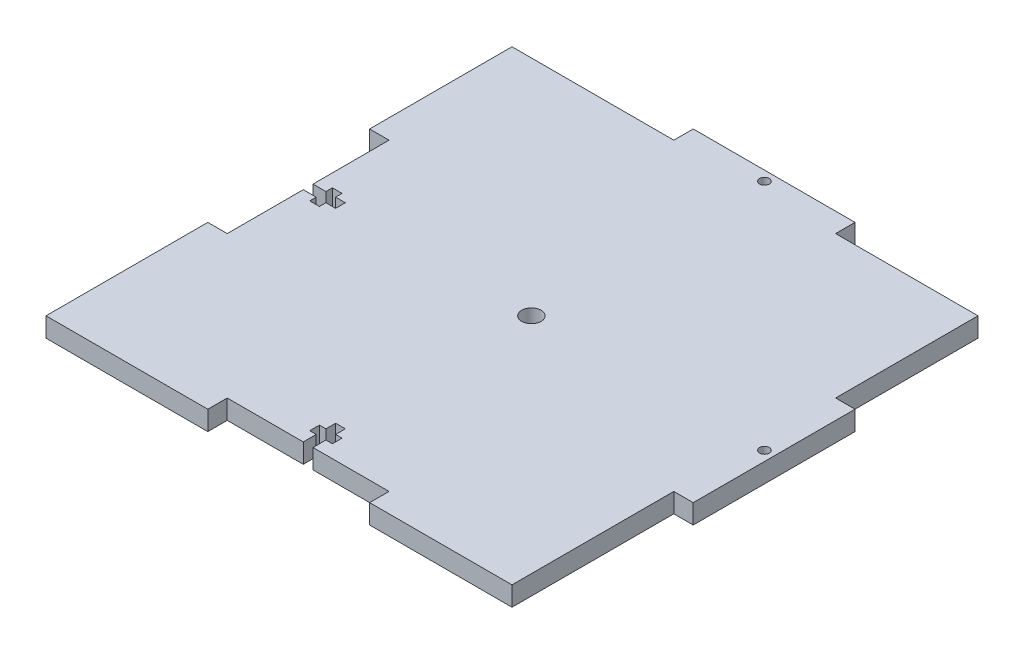
from build123d import *

# Parameters (mm, degrees)
SKETCH1_R           = 3
SKETCH1_R_2         = 1.5
BOSS_EXTRUDE1_DEPTH = 6


with BuildPart() as part:
    # Sketch1 → Boss-Extrude1 (new body)
    with BuildSketch(Plane(origin=(0, 0, 0), x_dir=(1, 0, 0), z_dir=(0, 1, 0))):
        Polygon((-72, 72), (-72, 28), (-66, 28), (-66, 4.5), (-62, 4.5), (-62, 6.5), (-59, 6.5), (-59, 4.5), (-56, 4.5), (-56, 1.5), (-59, 1.5), (-59, -0.5), (-62, -0.5), (-62, 1.5), (-66, 1.5), (-66, -22), (-72, -22), (-72, -72), (-22, -72), (-22, -66), (1.5, -66), (1.5, -62), (-0.5, -62), (-0.5, -59), (1.5, -59), (1.5, -56), (4.5, -56), (4.5, -59), (6.5, -59), (6.5, -62), (4.5, -62), (4.5, -66), (28, -66), (28, -72), (72, -72), (72, -22), (78, -22), (78, 28), (72, 28), (72, 72), (28, 72), (28, 78), (-22, 78), (-22, 72), align=None)
        with Locations(Location((3, 3, 0), (0, 0, 270))):
            Circle(SKETCH1_R, mode=Mode.SUBTRACT)
        with Locations(Location((3, 75, 0), (0, 0, 270))):
            Circle(SKETCH1_R_2, mode=Mode.SUBTRACT)
        with Locations(Location((75, 3, 0), (0, 0, 270))):
            Circle(SKETCH1_R_2, mode=Mode.SUBTRACT)
    extrude(amount=BOSS_EXTRUDE1_DEPTH)


solid = part.part
